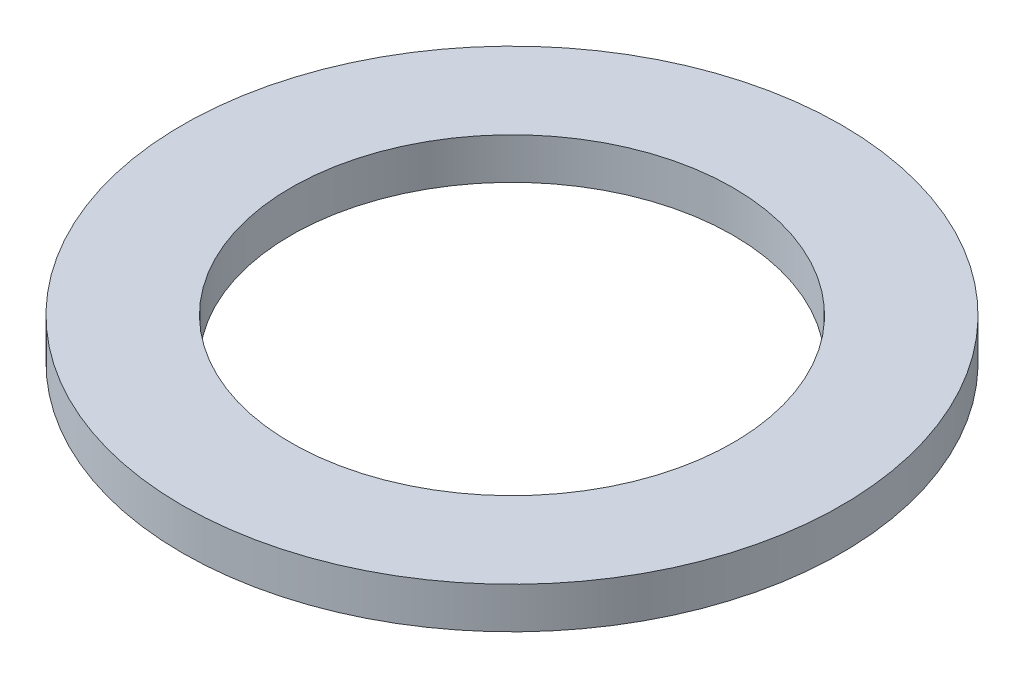
from build123d import *

# Parameters (mm, degrees)
CENTERING_RING_PROFILE_R   = 76.2
CENTERING_RING_PROFILE_R_2 = 51.1048
CENTERING_RING_BODY_DEPTH  = 9.525


with BuildPart() as part:
    # Centering Ring Profile → Centering Ring Body (new body)
    with BuildSketch(Plane(origin=(0, 0, 0), x_dir=(1, 0, 0), z_dir=(0, 1, 0))):
        with Locations(Location((0, 0, 0), (0, 0, 90))):
            Circle(CENTERING_RING_PROFILE_R)
        with Locations(Location((0, 0, 0), (0, 0, 90))):
            Circle(CENTERING_RING_PROFILE_R_2, mode=Mode.SUBTRACT)
    extrude(amount=CENTERING_RING_BODY_DEPTH)


solid = part.part
